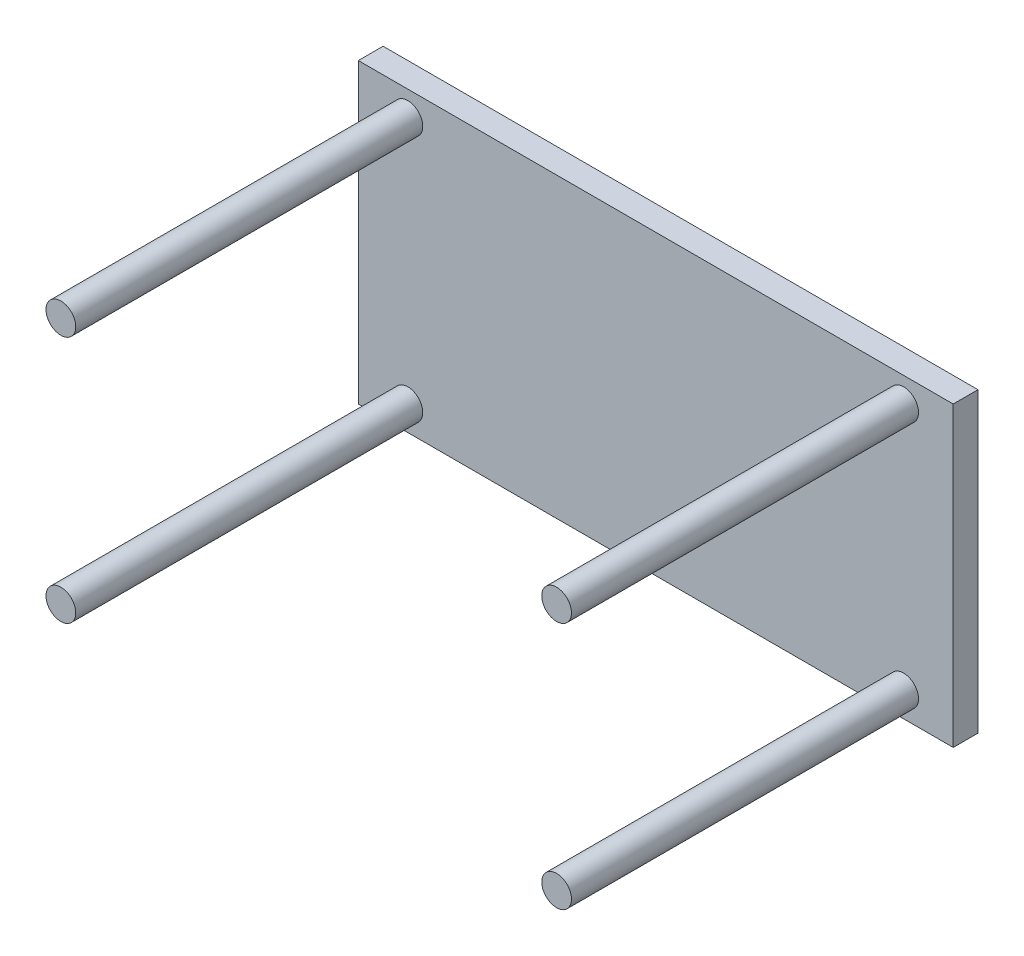
from build123d import *

# Parameters (mm, degrees)
SKETCH_1_W      = 1200
SKETCH_1_H      = 600
EXTRUDE_1_DEPTH = 50
SKETCH_2_R      = 30
EXTRUDE_2_DEPTH = 750
SKETCH_3_R      = 30
EXTRUDE_3_DEPTH = 750
SKETCH_4_R      = 30
EXTRUDE_4_DEPTH = 750
SKETCH_5_R      = 30
EXTRUDE_5_DEPTH = 750


with BuildPart() as part:
    # 草图1 → 凸台-拉伸1 (new body)
    with BuildSketch(Plane.XY):
        Rectangle(SKETCH_1_W, SKETCH_1_H)
    extrude(amount=EXTRUDE_1_DEPTH)

    # 草图2 → 凸台-拉伸2 (add)
    with BuildSketch(Plane.XY):
        with Locations(Location((-500, -250, 0), (0, 0, 180))):
            Circle(SKETCH_2_R)
    extrude(amount=EXTRUDE_2_DEPTH)

    # 草图3 → 凸台-拉伸3 (add)
    with BuildSketch(Plane.XY):
        with Locations(Location((500, -250, 0), (0, 0, 180))):
            Circle(SKETCH_3_R)
    extrude(amount=EXTRUDE_3_DEPTH)

    # 草图4 → 凸台-拉伸4 (add)
    with BuildSketch(Plane.XY):
        with Locations(Location((-500, 250, 0), (0, 0, 180))):
            Circle(SKETCH_4_R)
    extrude(amount=EXTRUDE_4_DEPTH)

    # 草图5 → 凸台-拉伸5 (add)
    with BuildSketch(Plane.XY):
        with Locations(Location((500, 250, 0), (0, 0, 180))):
            Circle(SKETCH_5_R)
    extrude(amount=EXTRUDE_5_DEPTH)


solid = part.part
